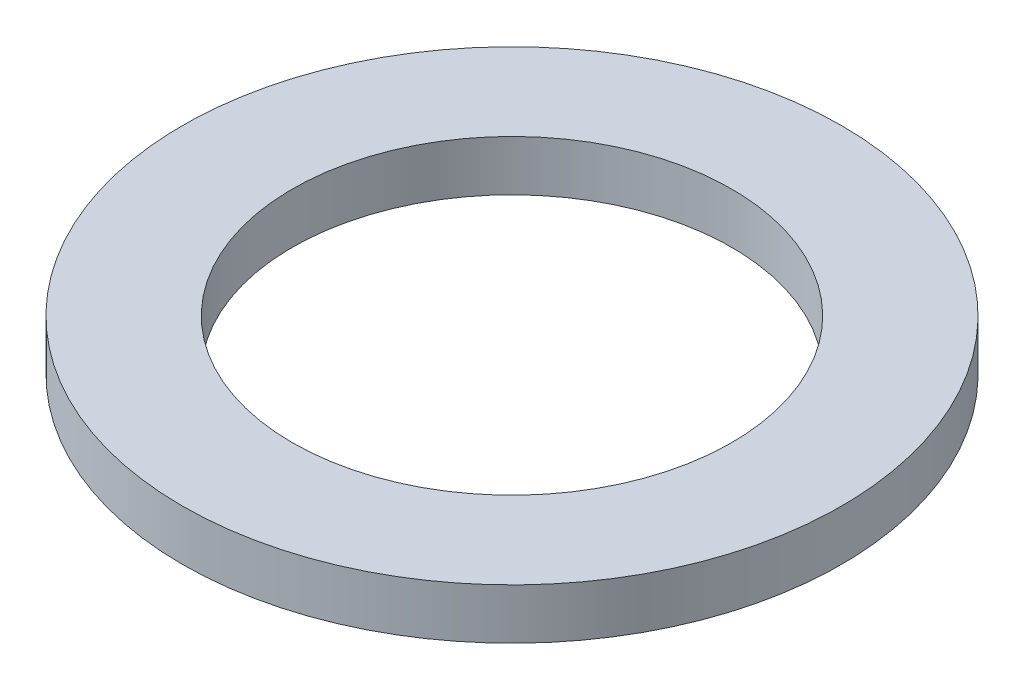
from build123d import *

# Parameters (mm, degrees)
ESQUISSE1_R        = 15
ESQUISSE1_R_2      = 10
BOSS_EXTRU_1_DEPTH = 2.3


with BuildPart() as part:
    # Esquisse1 → Boss.-Extru.1 (new body)
    with BuildSketch(Plane(origin=(0, 0, 0), x_dir=(1, 0, 0), z_dir=(0, 1, 0))):
        with Locations(Location((0, 0, 0), (0, 0, 270))):
            Circle(ESQUISSE1_R)
        with Locations(Location((0, 0, 0), (0, 0, 270))):
            Circle(ESQUISSE1_R_2, mode=Mode.SUBTRACT)
    extrude(amount=BOSS_EXTRU_1_DEPTH)


solid = part.part
